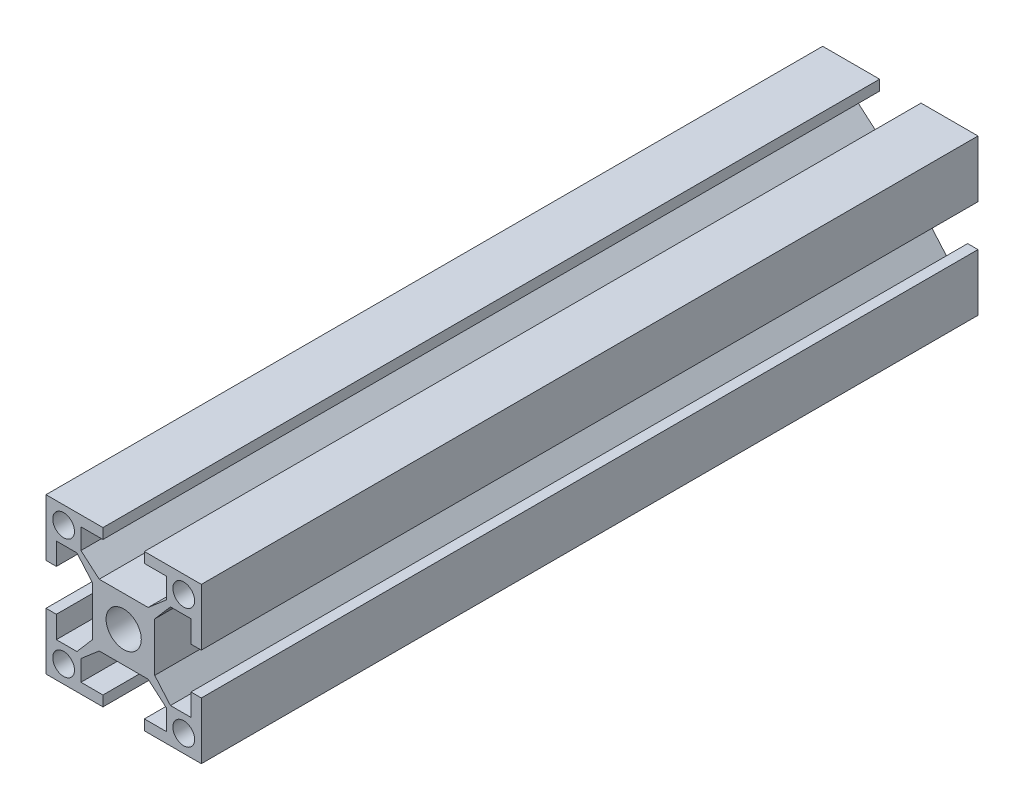
from build123d import *

# Parameters (mm, degrees)
SKETCH3_R           = 1.400007
SKETCH3_R_2         = 2.266678
BOSS_EXTRUDE1_DEPTH = 100


with BuildPart() as part:
    # Sketch3 → Boss-Extrude1 (new body)
    with BuildSketch(Plane.XY):
        Polygon((8.66671, -5.5000275), (6.019640257, -5.5000275), (4.00002, -3.150816419), (4.00002, 0), (4.00002, 3.150816419), (6.019640257, 5.5000275), (8.66671, 5.5000275), (8.66671, 2.66668), (10.00005, 2.66668), (10.00005, 10.00005), (2.66668, 10.00005), (2.66668, 8.66671), (5.5000275, 8.66671), (5.5000275, 6.019640257), (3.150816419, 4.00002), (0, 4.00002), (-3.150816419, 4.00002), (-5.5000275, 6.019640257), (-5.5000275, 8.66671), (-2.66668, 8.66671), (-2.66668, 10.00005), (-10.00005, 10.00005), (-10.00005, 2.66668), (-8.66671, 2.66668), (-8.66671, 5.5000275), (-6.019640257, 5.5000275), (-4.00002, 3.150816419), (-4.00002, 0), (-4.00002, -3.150816419), (-6.019640257, -5.5000275), (-8.66671, -5.5000275), (-8.66671, -2.66668), (-10.00005, -2.66668), (-10.00005, -10.00005), (-2.66668, -10.00005), (-2.66668, -8.66671), (-5.5000275, -8.66671), (-5.5000275, -6.019640257), (-3.150816419, -4.00002), (0, -4.00002), (3.150816419, -4.00002), (5.5000275, -6.019640257), (5.5000275, -8.66671), (2.66668, -8.66671), (2.66668, -10.00005), (10.00005, -10.00005), (10.00005, -2.66668), (8.66671, -2.66668), align=None)
        with Locations((7.733372, -7.733372)):
            Circle(SKETCH3_R, mode=Mode.SUBTRACT)
        with Locations((7.733372, 7.733372)):
            Circle(SKETCH3_R, mode=Mode.SUBTRACT)
        with Locations((-7.733372, 7.733372)):
            Circle(SKETCH3_R, mode=Mode.SUBTRACT)
        Circle(SKETCH3_R_2, mode=Mode.SUBTRACT)
        with Locations((-7.733372, -7.733372)):
            Circle(SKETCH3_R, mode=Mode.SUBTRACT)
    extrude(amount=BOSS_EXTRUDE1_DEPTH)


solid = part.part
